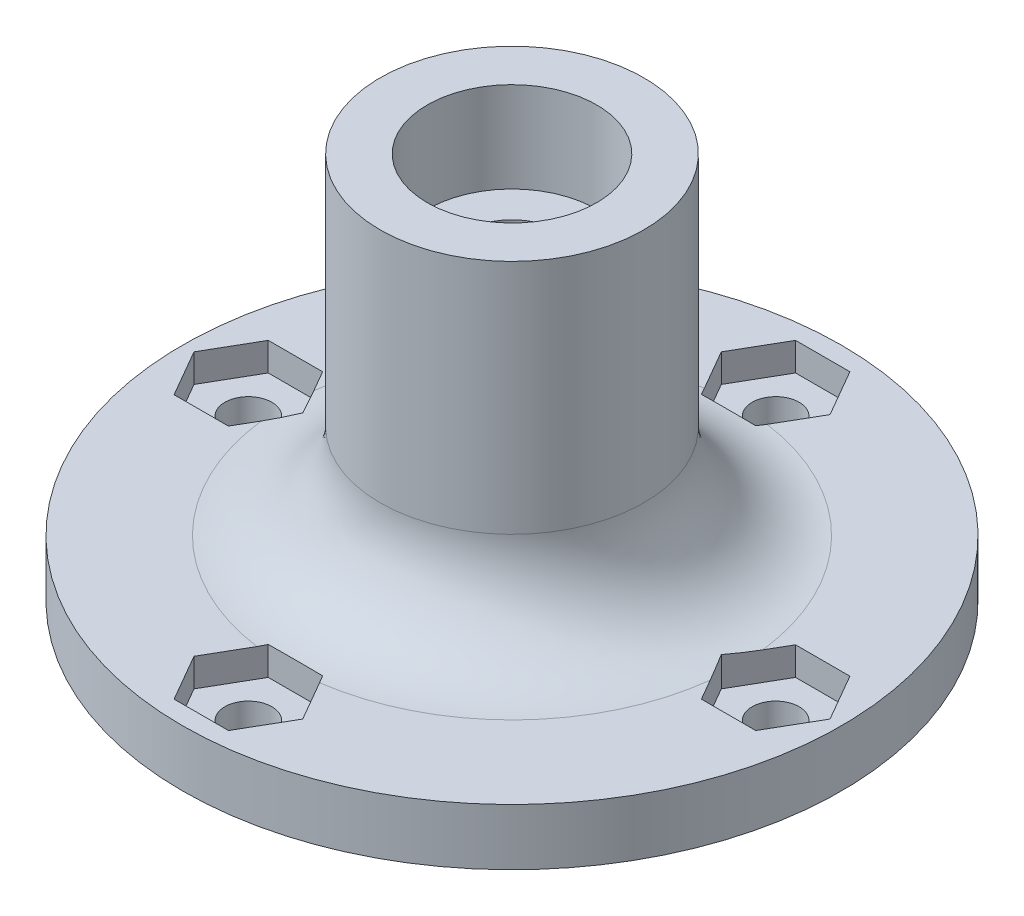
from build123d import *

# Parameters (mm, degrees)
SKETCH1_R               = 17.5
BOSS_EXTRUDE1_DEPTH     = 3
SKETCH2_R               = 7
BOSS_EXTRUDE2_DEPTH     = 12.75
SKETCH3_R               = 7
SKETCH3_R_2             = 4.5
BOSS_EXTRUDE3_DEPTH     = 4.8
SKETCH4_R               = 2.5
CUT_EXTRUDE1_DEPTH      = 19.8
FILLET1_R               = 5
SKETCH5_R               = 1.25
CUT_EXTRUDE2_DEPTH      = 3
CUT_EXTRUDE3_DEPTH      = 1.5
CUT_EXTRUDE3_DEPTH_BACK = 1.5


with BuildPart() as part:
    # Sketch1 → Boss-Extrude1 (new body)
    with BuildSketch(Plane(origin=(0, 0, 0), x_dir=(1, 0, 0), z_dir=(0, 1, 0))):
        with Locations(Location((0, 0, 0), (0, 0, 270))):
            Circle(SKETCH1_R)
    extrude(amount=BOSS_EXTRUDE1_DEPTH)

    # Sketch2 → Boss-Extrude2 (add)
    with BuildSketch(Plane(origin=(0, 3, 0), x_dir=(1, 0, 0), z_dir=(0, 1, 0))):
        with Locations(Location((0, 0, 0), (0, 0, 270))):
            Circle(SKETCH2_R)
    extrude(amount=BOSS_EXTRUDE2_DEPTH)

    # Sketch3 → Boss-Extrude3 (add)
    with BuildSketch(Plane(origin=(0, 15.75, 0), x_dir=(1, 0, 0), z_dir=(0, 1, 0))):
        with Locations(Location((0, 0, 0), (0, 0, 270))):
            Circle(SKETCH3_R)
        with Locations(Location((0, 0, 0), (0, 0, 270))):
            Circle(SKETCH3_R_2, mode=Mode.SUBTRACT)
    extrude(amount=BOSS_EXTRUDE3_DEPTH)

    # Sketch4 → Cut-Extrude1 (cut)
    with BuildSketch(Plane(origin=(0, 15.75, 0), x_dir=(1, 0, 0), z_dir=(0, 1, 0))):
        with Locations(Location((0, 0, 0), (0, 0, 270))):
            Circle(SKETCH4_R)
    extrude(amount=-CUT_EXTRUDE1_DEPTH, mode=Mode.SUBTRACT)

    # Fillet1
    fillet1_edges = [part.edges().sort_by_distance(p)[0] for p in [
        (0, 3, -7),
    ]]
    fillet(fillet1_edges, radius=FILLET1_R)

    # Sketch5 → Cut-Extrude2 (cut)
    with BuildSketch(Plane(origin=(0, 3, 0), x_dir=(1, 0, 0), z_dir=(0, 1, 0))):
        with Locations(Location((0, 14, 0), (0, 0, 270))):
            Circle(SKETCH5_R)
        with Locations(Location((14, 0, 0), (0, 0, 270))):
            Circle(SKETCH5_R)
        with Locations(Location((0, -14, 0), (0, 0, 270))):
            Circle(SKETCH5_R)
        with Locations(Location((-14, 0, 0), (0, 0, 270))):
            Circle(SKETCH5_R)
    extrude(amount=-CUT_EXTRUDE2_DEPTH, mode=Mode.SUBTRACT)

    # Sketch6 → Cut-Extrude3 (cut, two sides: drawn at the far end of the back side and taken through both)
    with BuildSketch(Plane(origin=(0, 3, 0), x_dir=(1, 0, 0), z_dir=(0, 1, 0)).offset(-CUT_EXTRUDE3_DEPTH_BACK)):
        Polygon((2.886751346, 14), (1.443375673, 16.5), (-1.443375673, 16.5), (-2.886751346, 14), (-1.443375673, 11.5), (1.443375673, 11.5), align=None)
        Polygon((16.886751346, 0), (15.443375673, 2.5), (12.556624327, 2.5), (11.113248654, 0), (12.556624327, -2.5), (15.443375673, -2.5), align=None)
        Polygon((2.886751346, -14), (1.443375673, -11.5), (-1.443375673, -11.5), (-2.886751346, -14), (-1.443375673, -16.5), (1.443375673, -16.5), align=None)
        Polygon((-11.113248654, 0), (-12.556624327, 2.5), (-15.443375673, 2.5), (-16.886751346, 0), (-15.443375673, -2.5), (-12.556624327, -2.5), align=None)
    extrude(amount=CUT_EXTRUDE3_DEPTH + CUT_EXTRUDE3_DEPTH_BACK, mode=Mode.SUBTRACT)


solid = part.part
